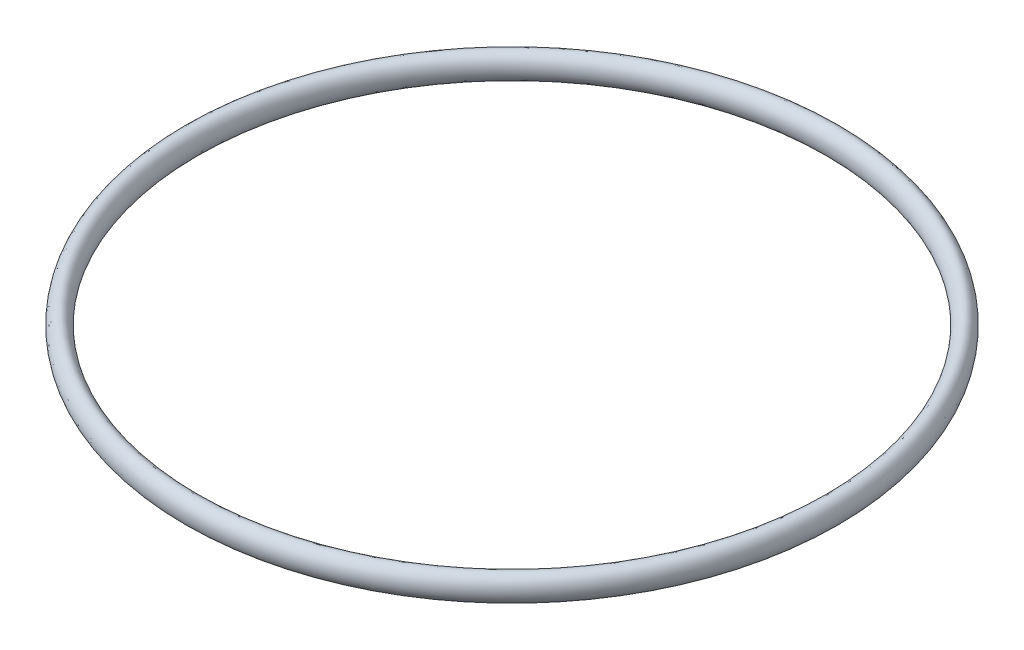
from build123d import *

# Parameters (mm, degrees)
SKETCH1_RX = 2
SKETCH1_RY = 1.5


with BuildPart() as part:
    # Sketch1 → Revolve1 (revolve)
    with BuildSketch(Plane(origin=(0, 0, 0), x_dir=(0, 0, -1), z_dir=(1, 0, 0))):
        with Locations(Location((49.25, 0), (0, 0, -90))):
            Ellipse(SKETCH1_RX, SKETCH1_RY)
    revolve(axis=Axis((0, 4.515463918, 0), (0, -1, 0)))


solid = part.part
